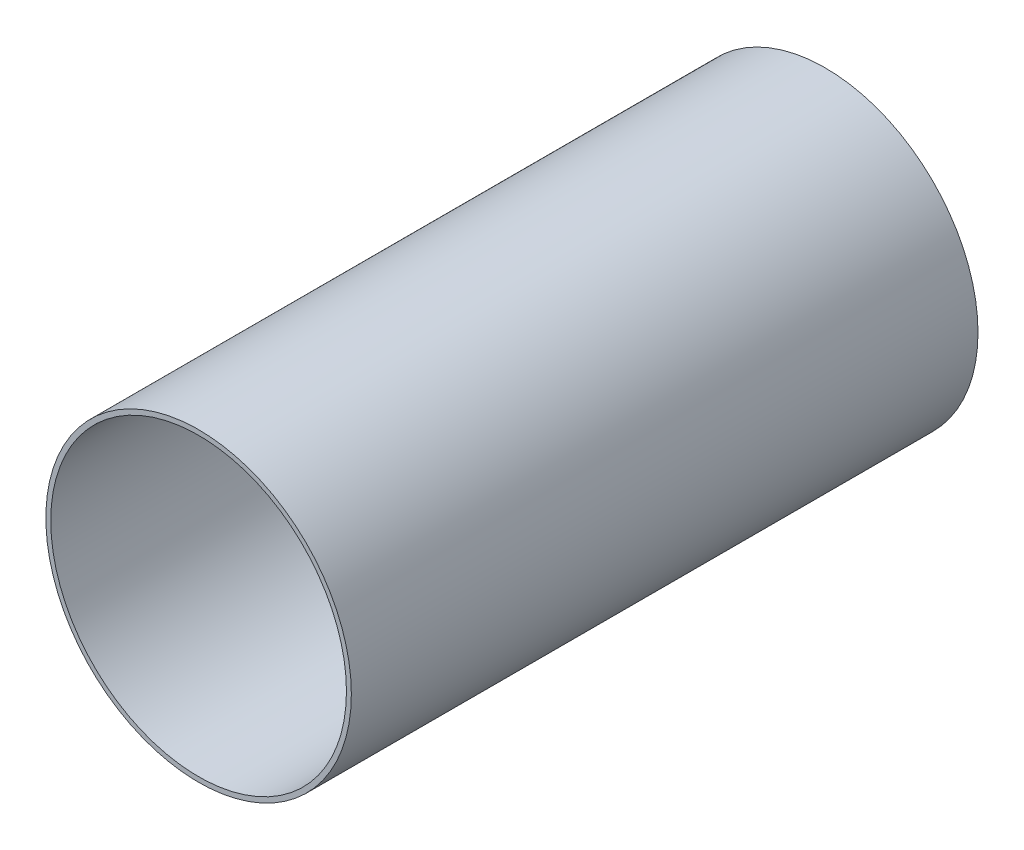
from build123d import *

# Parameters (mm, degrees)
SKETCH1_R           = 49.53
SKETCH1_R_2         = 47.9425
BOSS_EXTRUDE1_DEPTH = 203.2


with BuildPart() as part:
    # Sketch1 → Boss-Extrude1 (new body)
    with BuildSketch(Plane.XY):
        Circle(SKETCH1_R)
        Circle(SKETCH1_R_2, mode=Mode.SUBTRACT)
    extrude(amount=BOSS_EXTRUDE1_DEPTH)


solid = part.part
